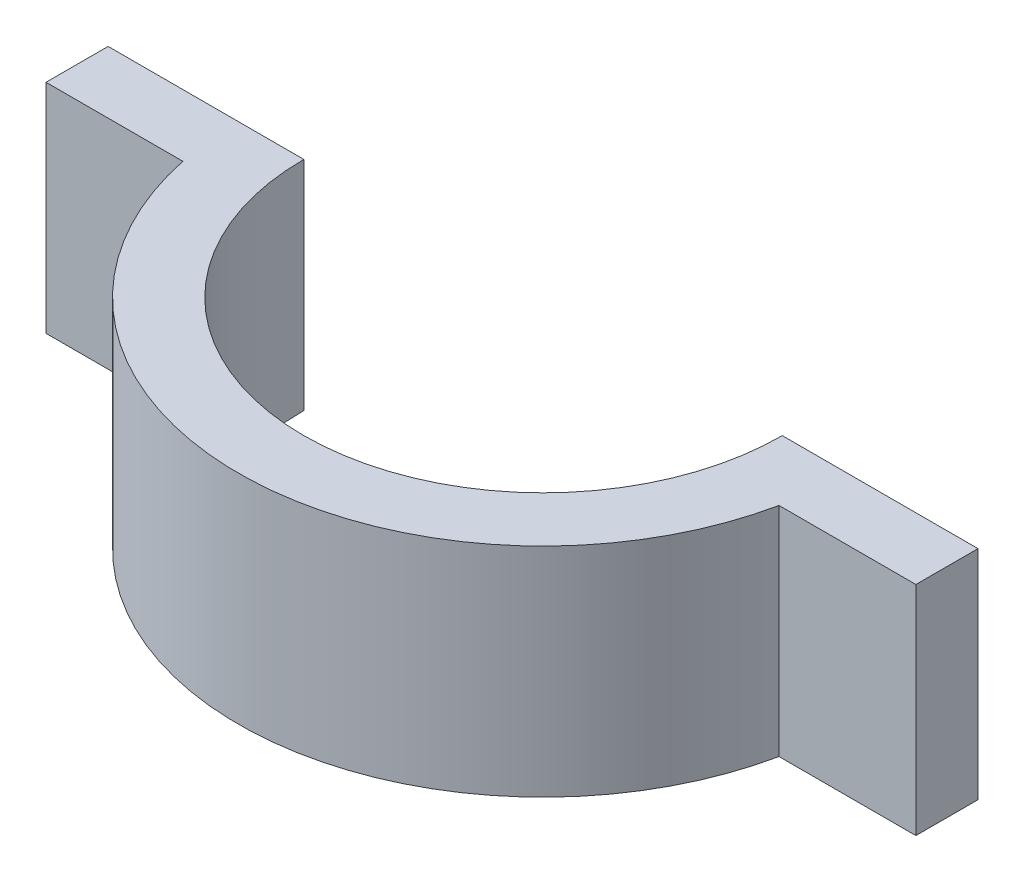
from build123d import *

# Parameters (mm, degrees)
BOSS_EXTRUDE1_DEPTH = 50
SKETCH3_W           = 14.282150027
SKETCH3_H           = 50
BOSS_EXTRUDE2_DEPTH = 100
CUT_EXTRUDE1_START  = -200
SKETCH4_R           = 55
CUT_EXTRUDE1_DEPTH  = 200


with BuildPart() as part:
    # Sketch1 → Boss-Extrude1 (new body)
    with BuildSketch(Plane(origin=(0, 0, 0), x_dir=(1, 0, 0), z_dir=(0, 1, 0))):
        with BuildLine():
            ThreePointArc((-70, 0), (0, -70), (70, 0))
            Line((70, 0), (55, 0))
            ThreePointArc((55, 0), (0, -55), (-55, 0))
            Line((-55, 0), (-70, 0))
        make_face()
    extrude(amount=BOSS_EXTRUDE1_DEPTH)

    # Sketch3 → Boss-Extrude2 (add, symmetric)
    with BuildSketch(Plane(origin=(0, 0, 0), x_dir=(0, 0, -1), z_dir=(1, 0, 0))):
        with Locations((-7.141075014, 25)):
            Rectangle(SKETCH3_W, SKETCH3_H)
    extrude(amount=BOSS_EXTRUDE2_DEPTH, both=True)

    # Sketch4 → Cut-Extrude1 (cut)
    with BuildSketch(Plane(origin=(0, 50, 0), x_dir=(1, 0, 0), z_dir=(0, 1, 0)).offset(CUT_EXTRUDE1_START)):
        Circle(SKETCH4_R)
    extrude(amount=CUT_EXTRUDE1_DEPTH, mode=Mode.SUBTRACT)


solid = part.part
